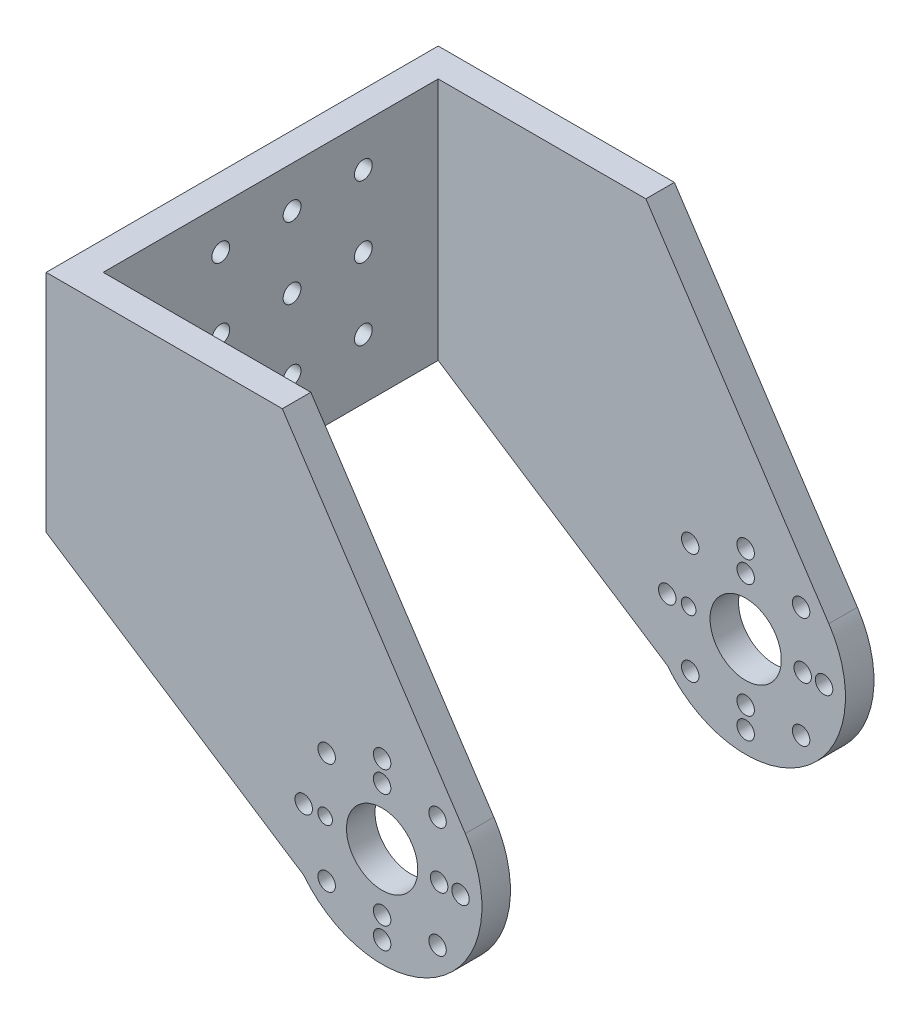
from build123d import *

# Parameters (mm, degrees)
SKETCH_1_R          = 5
SKETCH_1_R_2        = 1.225
SKETCH_1_R_3        = 1.025
EXTRUDE_1_DEPTH     = 55
SKETCH_2_W          = 57.132931415
SKETCH_2_H          = 47
CUT_EXTRUDE_1_DEPTH = 66
SKETCH_3_R          = 1.25
CUT_EXTRUDE_2_DEPTH = 49


with BuildPart() as part:
    # 스케치1 → 보스-돌출1 (new body)
    with BuildSketch(Plane.XY):
        with BuildLine():
            Line((11.674013781, 7.727703555), (-14, 46.512678751))
            Line((-14, 46.512678751), (-47.132931415, 46.512678751))
            Line((-47.132931415, 46.512678751), (-47.132931415, 14.921692086))
            Line((-47.132931415, 14.921692086), (-11, -8.660254038))
            ThreePointArc((-11, -8.660254038), (8.200906179, -11.346591463), (11.674013781, 7.727703555))
        make_face()
        Circle(SKETCH_1_R, mode=Mode.SUBTRACT)
        with Locations((0, 8)):
            Circle(SKETCH_1_R_2, mode=Mode.SUBTRACT)
        with Locations((0, 11)):
            Circle(SKETCH_1_R_2, mode=Mode.SUBTRACT)
        with Locations((7.778174593, 7.778174593)):
            Circle(SKETCH_1_R_2, mode=Mode.SUBTRACT)
        with Locations((8, 0)):
            Circle(SKETCH_1_R_2, mode=Mode.SUBTRACT)
        with Locations((11, 0)):
            Circle(SKETCH_1_R_2, mode=Mode.SUBTRACT)
        with Locations((7.778174593, -7.778174593)):
            Circle(SKETCH_1_R_2, mode=Mode.SUBTRACT)
        with Locations((0, -8)):
            Circle(SKETCH_1_R_2, mode=Mode.SUBTRACT)
        with Locations((0, -11)):
            Circle(SKETCH_1_R_2, mode=Mode.SUBTRACT)
        with Locations((-7.778174593, -7.778174593)):
            Circle(SKETCH_1_R_2, mode=Mode.SUBTRACT)
        with Locations((-8, 0)):
            Circle(SKETCH_1_R_3, mode=Mode.SUBTRACT)
        with Locations((-11, 0)):
            Circle(SKETCH_1_R_2, mode=Mode.SUBTRACT)
        with Locations((-7.778174593, 7.778174593)):
            Circle(SKETCH_1_R_2, mode=Mode.SUBTRACT)
    extrude(amount=EXTRUDE_1_DEPTH)

    # 스케치2 → 컷-돌출1 (cut)
    with BuildSketch(Plane(origin=(0, 46.512678751, 0), x_dir=(1, 0, 0), z_dir=(0, 1, 0))):
        with Locations((-14.566465708, -27.5)):
            Rectangle(SKETCH_2_W, SKETCH_2_H)
    extrude(amount=-CUT_EXTRUDE_1_DEPTH, mode=Mode.SUBTRACT)

    # 스케치3 → 컷-돌출2 (cut)
    with BuildSketch(Plane.ZY.offset(47.132931415)):
        with Locations(Location((24.5, 30.717185419, 0), (0, 0, 270))):
            Circle(SKETCH_3_R)
        with Locations(Location((14.5, 40.717185419, 0), (0, 0, 270))):
            Circle(SKETCH_3_R)
        with Locations(Location((34.5, 30.717185419, 0), (0, 0, 270))):
            Circle(SKETCH_3_R)
        with Locations(Location((24.5, 40.717185419, 0), (0, 0, 270))):
            Circle(SKETCH_3_R)
        with Locations(Location((14.5, 30.717185419, 0), (0, 0, 270))):
            Circle(SKETCH_3_R)
        with Locations(Location((34.5, 40.717185419, 0), (0, 0, 270))):
            Circle(SKETCH_3_R)
        with Locations(Location((14.5, 20.717185419, 0), (0, 0, 270))):
            Circle(SKETCH_3_R)
        with Locations(Location((24.5, 20.717185419, 0), (0, 0, 270))):
            Circle(SKETCH_3_R)
        with Locations(Location((34.5, 20.717185419, 0), (0, 0, 270))):
            Circle(SKETCH_3_R)
    extrude(amount=-CUT_EXTRUDE_2_DEPTH, mode=Mode.SUBTRACT)


solid = part.part
